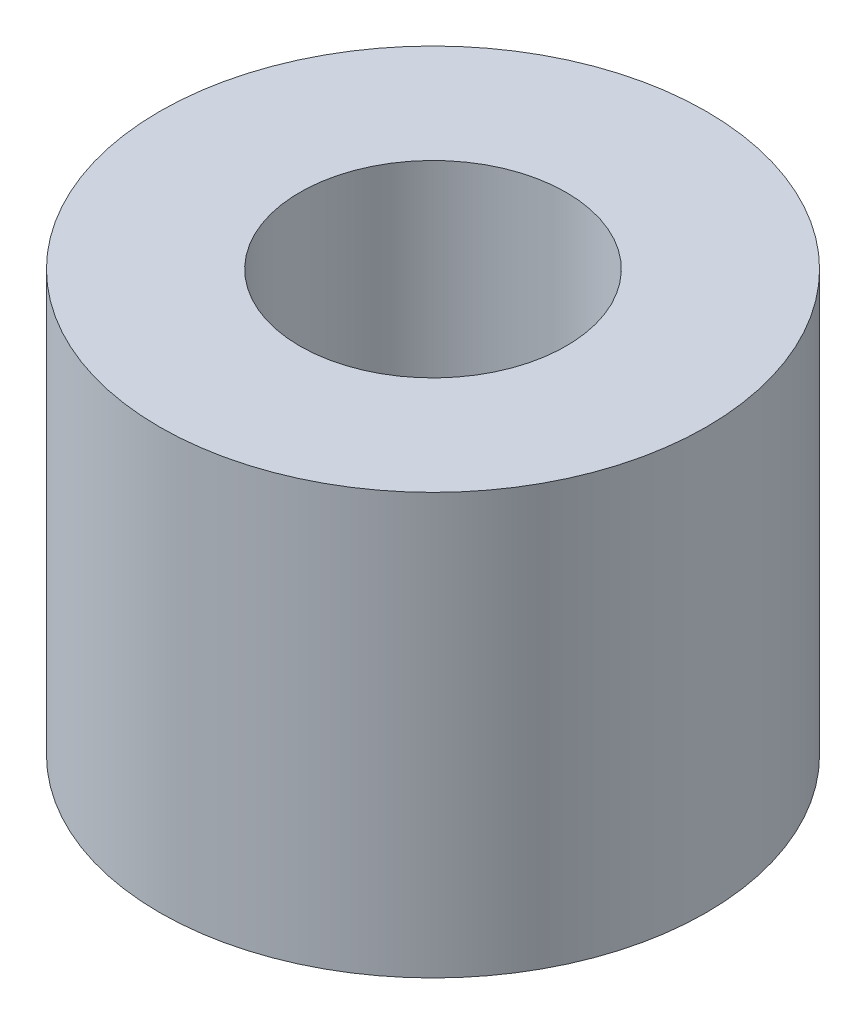
from build123d import *

# Parameters (mm, degrees)
SKETCH1_R           = 1.95
SKETCH1_R_2         = 0.95
BOSS_EXTRUDE1_DEPTH = 3


with BuildPart() as part:
    # Sketch1 → Boss-Extrude1 (new body)
    with BuildSketch(Plane(origin=(0, 0, 0), x_dir=(1, 0, 0), z_dir=(0, 1, 0))):
        with Locations(Location((0, 0, 0), (0, 0, 270))):
            Circle(SKETCH1_R)
        with Locations(Location((0, 0, 0), (0, 0, 270))):
            Circle(SKETCH1_R_2, mode=Mode.SUBTRACT)
    extrude(amount=BOSS_EXTRUDE1_DEPTH)


solid = part.part
